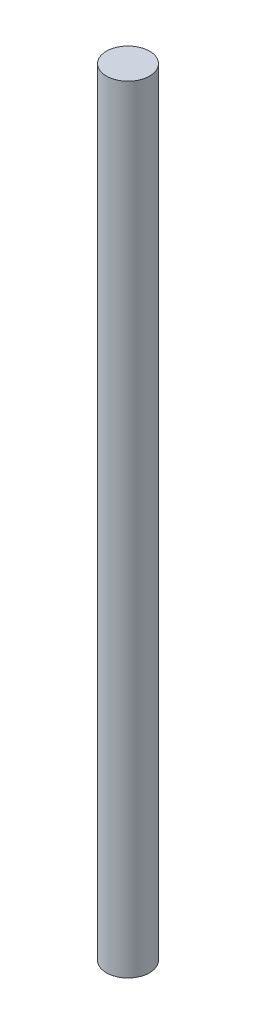
from build123d import *

# Parameters (mm, degrees)
SKETCH_1_R      = 15
EXTRUDE_1_DEPTH = 540


with BuildPart() as part:
    # 草图1 → 凸台-拉伸1 (new body)
    with BuildSketch(Plane(origin=(0, 0, 0), x_dir=(1, 0, 0), z_dir=(0, 1, 0))):
        with Locations(Location((0, 0, 0), (0, 0, 270))):
            Circle(SKETCH_1_R)
    extrude(amount=EXTRUDE_1_DEPTH)


solid = part.part
